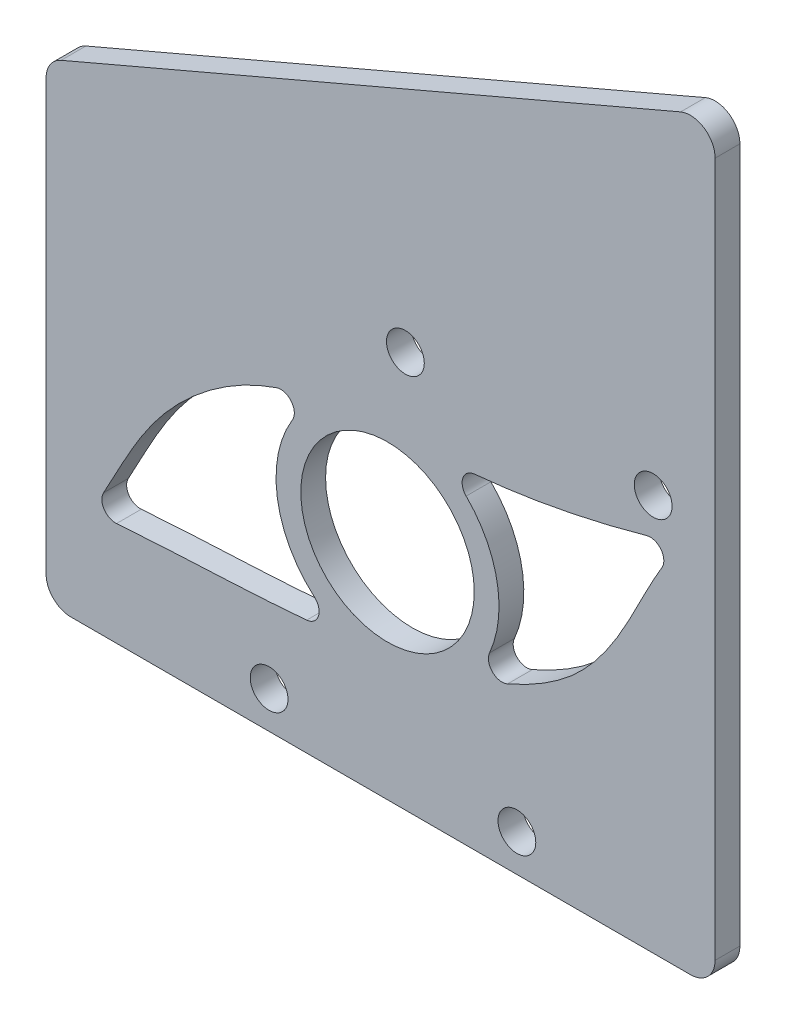
from build123d import *

# Parameters (mm, degrees)
SKETCH_1_W          = 54
SKETCH_1_H          = 72
EXTRUDE_1_DEPTH     = 2
CUT_EXTRUDE_1_DEPTH = 2
SKETCH_4_R          = 1.525
CUT_EXTRUDE_2_DEPTH = 10
CUT_EXTRUDE_3_DEPTH = 2
SKETCH_6_R          = 9
SKETCH_6_R_2        = 7
EXTRUDE_2_DEPTH     = 2
FILLET_1_R          = 1.1
FILLET_2_R          = 2


with BuildPart() as part:
    # 草图1 → 凸台-拉伸1 (new body)
    with BuildSketch(Plane.XY):
        Rectangle(SKETCH_1_W, SKETCH_1_H)
    extrude(amount=EXTRUDE_1_DEPTH)

    # 草图2 → 切除-拉伸1 (cut)
    with BuildSketch(Plane.XY.offset(2)):
        Polygon((-27, 2), (27, 25.105342179), (27, 36), (-27, 36), align=None)
    extrude(amount=-CUT_EXTRUDE_1_DEPTH, mode=Mode.SUBTRACT)

    # 草图4 → 切除-拉伸2 (cut)
    with BuildSketch(Plane.XY.offset(2)):
        with Locations((-9, -33)):
            Circle(SKETCH_4_R)
        with Locations((11, -33)):
            Circle(SKETCH_4_R)
        with Locations((2, -4)):
            Circle(SKETCH_4_R)
        with Locations((22, -4)):
            Circle(SKETCH_4_R)
    extrude(amount=-CUT_EXTRUDE_2_DEPTH, mode=Mode.SUBTRACT)

    # 草图5 → 切除-拉伸3 (cut)
    with BuildSketch(Plane.XY.offset(2)):
        with BuildLine():
            add(Edge.make_bspline(
                [(-23.397341502, -27.80348221), (-21.673234043, -24.952193686), (-18.841423513, -18.327485381), (-10.833901378, -11.756527748), (-1.499041268, -10.102711826), (9.981460044, -9.932321008), (18.81490672, -7.97288353), (24.483468669, -6.167126568)],
                knots=[0, 0, 0, 0, 0.178737613, 0.383542115, 0.520640135, 0.67991784, 1, 1, 1, 1], degree=3))
            add(Edge.make_bspline(
                [(-23.397341502, -27.80348221), (-13.158468218, -26.821678375), (0.76741254, -27.683363702), (15.176508339, -20.910209598), (20.355493831, -13.972924669), (22.163544803, -8.919372749), (24.483468669, -6.167126568)],
                knots=[0, 0, 0, 0, 0.548813094, 0.719371647, 0.81105697, 1, 1, 1, 1], degree=3))
        make_face()
    extrude(amount=-CUT_EXTRUDE_3_DEPTH, mode=Mode.SUBTRACT)

    # 草图6 → 凸台-拉伸2 (add)
    with BuildSketch(Plane.XY.offset(2)):
        with Locations((0.558156392, -17.980778356)):
            Circle(SKETCH_6_R)
        with Locations((0.558156392, -17.980778356)):
            Circle(SKETCH_6_R_2, mode=Mode.SUBTRACT)
    extrude(amount=-EXTRUDE_2_DEPTH)

    # 圆角1
    fillet_1_edges = [part.edges().sort_by_distance(p)[0] for p in [
        (6.982938033, -24.283331876, 1),
        (-2.733607094, -26.357191261, 1),
        (-23.397341502, -27.80348221, 1),
        (24.483468669, -6.167126568, 1),
        (-4.823851044, -10.767318995, 1),
        (4.597302123, -9.938061044, 1),
    ]]
    fillet(fillet_1_edges, radius=FILLET_1_R)

    # 圆角2
    fillet_2_edges = [part.edges().sort_by_distance(p)[0] for p in [
        (-27, 2, 1),
        (27, 25.105342179, 1),
        (27, -36, 1),
        (-27, -36, 1),
    ]]
    fillet(fillet_2_edges, radius=FILLET_2_R)


solid = part.part
